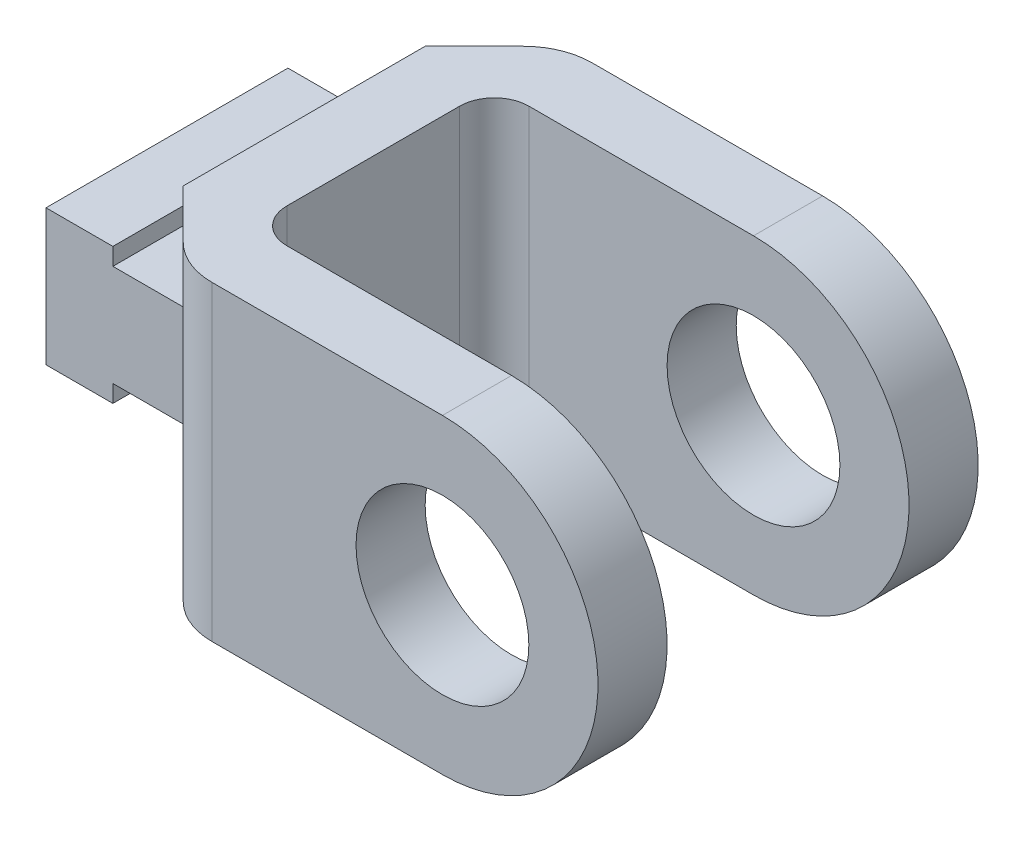
from build123d import *

# Parameters (mm, degrees)
SKETCH1_W                = 2
SKETCH1_H                = 9
BOSS_EXTRUDE2_DEPTH      = 7
BOSS_EXTRUDE4_DEPTH      = 3.5
BOSS_EXTRUDE4_DEPTH_BACK = 3.5
SKETCH2_R                = 2.5
BOSS_EXTRUDE3_DEPTH      = 2
CUT_EXTRUDE3_DEPTH       = 18.291616466
FILLET1_R                = 1
FILLET2_R                = 2
FILLET2_OF_MIRROR2_R     = 2
FILLET3_R                = 1


with BuildPart() as part:
    # Sketch1 → Boss-Extrude2 (new body)
    with BuildSketch(Plane.XY):
        Rectangle(SKETCH1_W, SKETCH1_H)
    boss_extrude2 = extrude(amount=BOSS_EXTRUDE2_DEPTH)

    # Sketch5 → Boss-Extrude4 (add, two sides: drawn at the far end of the back side and taken through both)
    with BuildSketch(Plane.XY.offset(3.5).offset(-BOSS_EXTRUDE4_DEPTH_BACK)):
        Polygon((-3.035, -1.4675), (-1, -1.4675), (-1, 1.4675), (-3.035, 1.4675), (-3.035, 1.9675), (-4.97, 1.9675), (-4.97, -1.9675), (-3.035, -1.9675), align=None)
    extrude(amount=BOSS_EXTRUDE4_DEPTH + BOSS_EXTRUDE4_DEPTH_BACK)

    # Sketch2 → Boss-Extrude3 (add)
    with BuildSketch(Plane.XY):
        with BuildLine():
            Line((-1, 4.5), (8.5, 4.5))
            ThreePointArc((8.5, 4.5), (13, 0), (8.5, -4.5))
            Line((8.5, -4.5), (-1, -4.5))
            Line((-1, -4.5), (-1, 4.5))
        make_face()
        with Locations((8.5, 0)):
            Circle(SKETCH2_R, mode=Mode.SUBTRACT)
    boss_extrude3 = extrude(amount=-BOSS_EXTRUDE3_DEPTH)

    # Sketch4 → Cut-Extrude3 (cut, through all)
    with BuildSketch(Plane(origin=(0, 4.5, 0), x_dir=(1, 0, 0), z_dir=(0, 1, 0))):
        Polygon((-1, 0), (1, 2), (-1, 2), align=None)
    cut_extrude3 = extrude(amount=-CUT_EXTRUDE3_DEPTH, mode=Mode.SUBTRACT)

    # Fillet1
    fillet1_edges = [part.edges().sort_by_distance(p)[0] for p in [
        (1, 0, 0),
    ]]
    fillet(fillet1_edges, radius=FILLET1_R)

    # Fillet2
    fillet2_edges = [part.edges().sort_by_distance(p)[0] for p in [
        (1, 0, -2),
    ]]
    fillet(fillet2_edges, radius=FILLET2_R)

    # Mirror2: Boss-Extrude2, Boss-Extrude3, Cut-Extrude3 across plane
    add(boss_extrude2.mirror(Plane.XY.offset(3.5)))
    add(boss_extrude3.mirror(Plane.XY.offset(3.5)))
    add(cut_extrude3.mirror(Plane.XY.offset(3.5)), mode=Mode.SUBTRACT)

    # Fillet2 of Mirror2
    fillet2_of_mirror2_edges = [part.edges().sort_by_distance(p)[0] for p in [
        (1, 0, 9),
    ]]
    fillet(fillet2_of_mirror2_edges, radius=FILLET2_OF_MIRROR2_R)

    # Fillet3
    fillet3_edges = [part.edges().sort_by_distance(p)[0] for p in [
        (1, 0, 7),
    ]]
    fillet(fillet3_edges, radius=FILLET3_R)


solid = part.part
